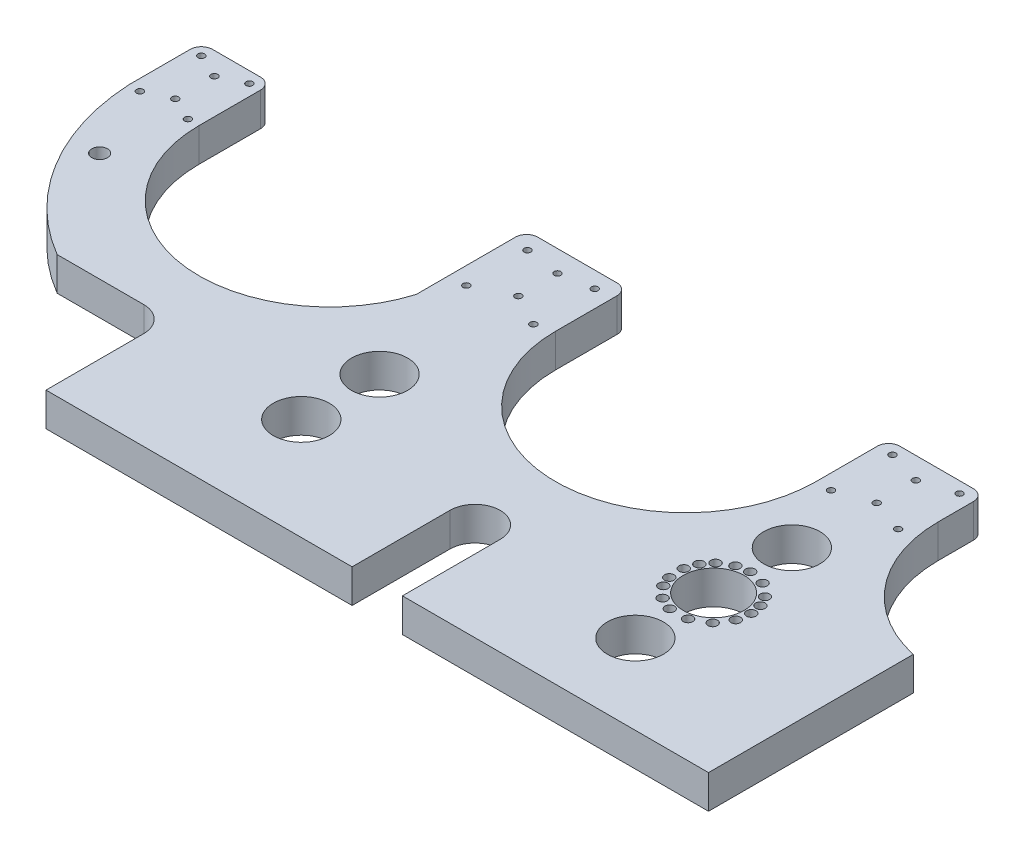
from build123d import *

# Parameters (mm, degrees)
SKETCH3_R           = 7
SKETCH3_R_2         = 3
SKETCH3_R_3         = 25.1
SKETCH3_R_4         = 27.215273825
SKETCH3_R_5         = 4.25
BOSS_EXTRUDE2_DEPTH = 30


with BuildPart() as part:
    # Sketch3 → Boss-Extrude2 (new body)
    with BuildSketch(Plane(origin=(0, 0, 0), x_dir=(1, 0, 0), z_dir=(0, 1, 0))):
        with BuildLine():
            Line((0, 0), (273.87, 0))
            Line((273.87, 0), (273.87, 87.5))
            ThreePointArc((273.87, 87.5), (296.37, 110), (318.87, 87.5))
            Line((318.87, 87.5), (318.87, 0))
            Line((318.87, 0), (592.74, 0))
            Line((592.74, 0), (592.74, 183.19))
            ThreePointArc((592.74, 183.19), (526.952473324, 223.969990415), (501.24, 296.97598332))
            Line((501.24, 296.97598332), (501.24, 328.489999343))
            ThreePointArc((501.24, 328.489999343), (498.311067812, 335.561067155), (491.24, 338.489999343))
            Line((491.24, 338.489999343), (425.37, 338.489999343))
            ThreePointArc((425.37, 338.489999343), (418.298932188, 335.561067155), (415.37, 328.489999343))
            Line((415.37, 328.489999343), (415.37, 273.489999343))
            ThreePointArc((415.37, 273.489999343), (298.87, 156.989999343), (182.37, 273.489999343))
            Line((182.37, 273.489999343), (182.37, 328.489999343))
            ThreePointArc((182.37, 328.489999343), (179.441067812, 335.561067155), (172.37, 338.489999343))
            Line((172.37, 338.489999343), (101.5, 338.489999343))
            ThreePointArc((101.5, 338.489999343), (94.428932188, 335.561067155), (91.5, 328.489999343))
            Line((91.5, 328.489999343), (91.5, 239.726113311))
            ThreePointArc((91.5, 239.726113311), (-37.066048166, 158.246778284), (-136.5, 273.489999343))
            Line((-136.5, 273.489999343), (-136.5, 328.489999343))
            ThreePointArc((-136.5, 328.489999343), (-139.428932188, 335.561067155), (-146.5, 338.489999343))
            Line((-146.5, 338.489999343), (-189.5, 338.489999343))
            ThreePointArc((-189.5, 338.489999343), (-196.571067812, 335.561067155), (-199.5, 328.489999343))
            Line((-199.5, 328.489999343), (-199.5, 273.489999343))
            ThreePointArc((-199.5, 273.489999343), (-170.358013315, 179.208137798), (-100.012022841, 109.999999343))
            Line((-100.012022841, 109.999999343), (-22.509563758, 109.999999343))
            ThreePointArc((-22.509563758, 109.999999343), (-6.60053067, 103.410771361), (-0.009563892, 87.50245856))
            Line((-0.009563892, 87.50245856), (0, 0))
        make_face()
        with Locations(Location((-159.5, 207.499999343, 0), (0, 0, 270))):
            Circle(SKETCH3_R, mode=Mode.SUBTRACT)
        with Locations(Location((-189.5, 328.489999343, 0), (0, 0, 270))):
            Circle(SKETCH3_R_2, mode=Mode.SUBTRACT)
        with Locations(Location((-146.5, 328.489999343, 0), (0, 0, 270))):
            Circle(SKETCH3_R_2, mode=Mode.SUBTRACT)
        with Locations(Location((-167.860538183, 318.489999343, 0), (0, 0, 270))):
            Circle(SKETCH3_R_2, mode=Mode.SUBTRACT)
        with Locations(Location((-146.5, 273.489999343, 0), (0, 0, 270))):
            Circle(SKETCH3_R_2, mode=Mode.SUBTRACT)
        with Locations(Location((-167.860538183, 283.489999343, 0), (0, 0, 270))):
            Circle(SKETCH3_R_2, mode=Mode.SUBTRACT)
        with Locations(Location((-189.5, 273.489999343, 0), (0, 0, 270))):
            Circle(SKETCH3_R_2, mode=Mode.SUBTRACT)
        with Locations(Location((166.986079988, 269.062698156, 0), (0, 0, 270))):
            Circle(SKETCH3_R_2, mode=Mode.SUBTRACT)
        with Locations(Location((166.986079988, 323.925123651, 0), (0, 0, 270))):
            Circle(SKETCH3_R_2, mode=Mode.SUBTRACT)
        with Locations(Location((138.449645935, 319.171398702, 0), (0, 0, 270))):
            Circle(SKETCH3_R_2, mode=Mode.SUBTRACT)
        with Locations(Location((106.986375646, 269.062698156, 0), (0, 0, 270))):
            Circle(SKETCH3_R_2, mode=Mode.SUBTRACT)
        with Locations(Location((106.986375646, 323.736765186, 0), (0, 0, 270))):
            Circle(SKETCH3_R_2, mode=Mode.SUBTRACT)
        with Locations(Location((488.822646039, 273.49, 0), (0, 0, 270))):
            Circle(SKETCH3_R_2, mode=Mode.SUBTRACT)
        with Locations(Location((488.822646039, 328.49, 0), (0, 0, 270))):
            Circle(SKETCH3_R_2, mode=Mode.SUBTRACT)
        with Locations(Location((459.034690833, 319.171398702, 0), (0, 0, 270))):
            Circle(SKETCH3_R_2, mode=Mode.SUBTRACT)
        with Locations(Location((428.822646039, 273.49, 0), (0, 0, 270))):
            Circle(SKETCH3_R_2, mode=Mode.SUBTRACT)
        with Locations(Location((428.822646039, 328.49, 0), (0, 0, 270))):
            Circle(SKETCH3_R_2, mode=Mode.SUBTRACT)
        with Locations(Location((138.449645935, 284.171398702, 0), (0, 0, 270))):
            Circle(SKETCH3_R_2, mode=Mode.SUBTRACT)
        with Locations(Location((459.034690833, 284.171398702, 0), (0, 0, 270))):
            Circle(SKETCH3_R_2, mode=Mode.SUBTRACT)
        with Locations(Location((136.93, 161.5, 0), (0, 0, 270))):
            Circle(SKETCH3_R_3, mode=Mode.SUBTRACT)
        with Locations(Location((136.93, 91.5, 0), (0, 0, 270))):
            Circle(SKETCH3_R_3, mode=Mode.SUBTRACT)
        with Locations(Location((455.81, 211.5, 0), (0, 0, 270))):
            Circle(SKETCH3_R_3, mode=Mode.SUBTRACT)
        with Locations(Location((455.81, 71.5, 0), (0, 0, 270))):
            Circle(SKETCH3_R_3, mode=Mode.SUBTRACT)
        with Locations(Location((455.81, 141.5, 0), (0, 0, 270))):
            Circle(SKETCH3_R_4, mode=Mode.SUBTRACT)
        with Locations(Location((455.81, 174.25, 0), (0, 0, 270))):
            Circle(SKETCH3_R_5, mode=Mode.SUBTRACT)
        with Locations(Location((470.12937162, 170.953660153, 0), (0, 0, 270))):
            Circle(SKETCH3_R_5, mode=Mode.SUBTRACT)
        with Locations(Location((481.743809978, 161.5, 0), (0, 0, 270))):
            Circle(SKETCH3_R_5, mode=Mode.SUBTRACT)
        with Locations(Location((486.641730392, 152.543862595, 0), (0, 0, 270))):
            Circle(SKETCH3_R_5, mode=Mode.SUBTRACT)
        with Locations(Location((488.54728895, 142.41236627, 0), (0, 0, 270))):
            Circle(SKETCH3_R_5, mode=Mode.SUBTRACT)
        with Locations(Location((486.641730392, 130.456137405, 0), (0, 0, 270))):
            Circle(SKETCH3_R_5, mode=Mode.SUBTRACT)
        with Locations(Location((478.633688814, 117.855315192, 0), (0, 0, 270))):
            Circle(SKETCH3_R_5, mode=Mode.SUBTRACT)
        with Locations(Location((464.525450227, 109.930973608, 0), (0, 0, 270))):
            Circle(SKETCH3_R_5, mode=Mode.SUBTRACT)
        with Locations(Location((448.462502984, 109.584850187, 0), (0, 0, 270))):
            Circle(SKETCH3_R_5, mode=Mode.SUBTRACT)
        with Locations(Location((437.02438353, 114.673462507, 0), (0, 0, 270))):
            Circle(SKETCH3_R_5, mode=Mode.SUBTRACT)
        with Locations(Location((427.857640986, 124.434592722, 0), (0, 0, 270))):
            Circle(SKETCH3_R_5, mode=Mode.SUBTRACT)
        with Locations(Location((424.022707805, 133.61770624, 0), (0, 0, 270))):
            Circle(SKETCH3_R_5, mode=Mode.SUBTRACT)
        with Locations(Location((423.572722, 147.036738763, 0), (0, 0, 270))):
            Circle(SKETCH3_R_5, mode=Mode.SUBTRACT)
        with Locations(Location((427.166538269, 157.378117019, 0), (0, 0, 270))):
            Circle(SKETCH3_R_5, mode=Mode.SUBTRACT)
        with Locations(Location((433.541295108, 165.513897694, 0), (0, 0, 270))):
            Circle(SKETCH3_R_5, mode=Mode.SUBTRACT)
        with Locations(Location((444.546820962, 172.252289312, 0), (0, 0, 270))):
            Circle(SKETCH3_R_5, mode=Mode.SUBTRACT)
    extrude(amount=BOSS_EXTRUDE2_DEPTH)


solid = part.part
